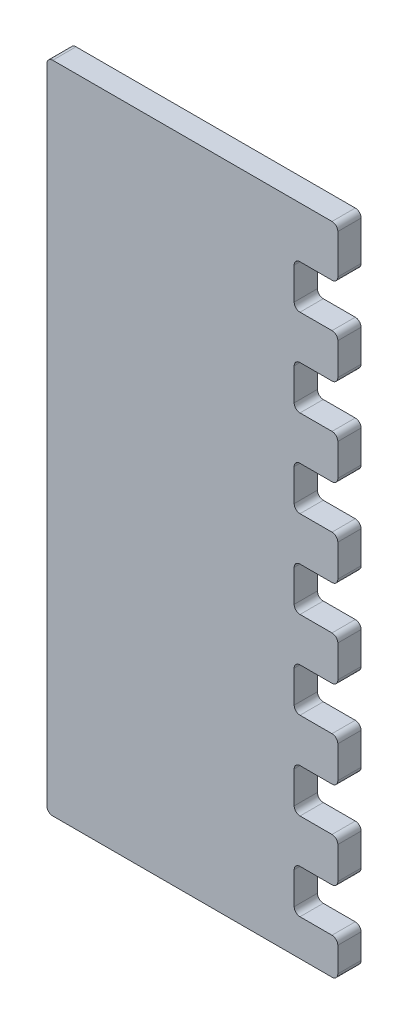
from build123d import *

# Parameters (mm, degrees)
SKETCH1_W           = 200
SKETCH1_H           = 450
BOSS_EXTRUDE1_DEPTH = 16
SKETCH2_W           = 30
SKETCH2_H           = 30
CUT_EXTRUDE8_DEPTH  = 462.254810273
LPATTERN1_COUNT     = 7
LPATTERN1_PITCH     = 60
FILLET1_R           = 4


with BuildPart() as part:
    # Sketch1 → Boss-Extrude1 (new body)
    with BuildSketch(Plane.XY):
        with Locations((0, 225)):
            Rectangle(SKETCH1_W, SKETCH1_H)
    extrude(amount=BOSS_EXTRUDE1_DEPTH)

    # Sketch2 → Cut-Extrude8 (cut, symmetric)
    with BuildSketch(Plane.XY.offset(16)):
        with Locations((85, 40)):
            Rectangle(SKETCH2_W, SKETCH2_H)
    cut_extrude8 = extrude(amount=CUT_EXTRUDE8_DEPTH, both=True, mode=Mode.SUBTRACT)

    # LPattern1: Cut-Extrude8 ×7
    with Locations(*[(0, i * LPATTERN1_PITCH, 0) for i in range(1, LPATTERN1_COUNT)]):
        add(cut_extrude8, mode=Mode.SUBTRACT)

    # Fillet1
    fillet1_edges = [part.edges().sort_by_distance(p)[0] for p in [
        (70, 355, 8),
        (100, 355, 8),
        (100, 325, 8),
        (70, 325, 8),
        (70, 415, 8),
        (100, 415, 8),
        (100, 385, 8),
        (70, 385, 8),
        (70, 55, 8),
        (100, 55, 8),
        (100, 25, 8),
        (70, 25, 8),
        (70, 115, 8),
        (100, 115, 8),
        (100, 85, 8),
        (70, 85, 8),
        (70, 175, 8),
        (100, 175, 8),
        (100, 145, 8),
        (70, 145, 8),
        (-100, 450, 8),
        (100, 450, 8),
        (100, 0, 8),
        (-100, 0, 8),
        (70, 235, 8),
        (100, 235, 8),
        (100, 205, 8),
        (70, 205, 8),
        (70, 295, 8),
        (100, 295, 8),
        (100, 265, 8),
        (70, 265, 8),
    ]]
    fillet(fillet1_edges, radius=FILLET1_R)


solid = part.part
